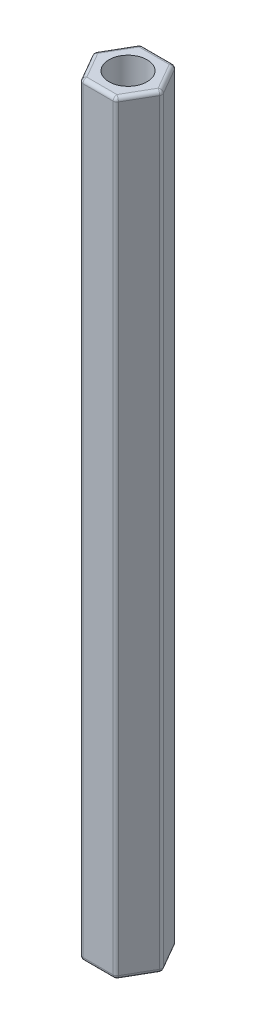
from build123d import *

# Parameters (mm, degrees)
SKETCH_1_R      = 1.5
EXTRUDE_1_DEPTH = 60
FILLET_1_R      = 0.3


with BuildPart() as part:
    # 草图1 → 凸台-拉伸1 (new body)
    with BuildSketch(Plane(origin=(0, 0, 0), x_dir=(1, 0, 0), z_dir=(0, 1, 0))):
        Polygon((2.713546265, 0), (1.356773133, 2.35), (-1.356773133, 2.35), (-2.713546265, 0), (-1.356773133, -2.35), (1.356773133, -2.35), align=None)
        with Locations(Location((0, 0, 0), (0, 0, 270))):
            Circle(SKETCH_1_R, mode=Mode.SUBTRACT)
    extrude(amount=EXTRUDE_1_DEPTH)

    # 圆角1
    fillet_1_edges = [part.edges().sort_by_distance(p)[0] for p in [
        (0, 60, -2.35),
        (1.356773133, 30, 2.35),
        (-1.356773133, 30, 2.35),
        (-2.713546265, 30, 0),
        (-1.356773133, 30, -2.35),
        (1.356773133, 30, -2.35),
        (2.713546265, 30, 0),
        (-2.035159699, 60, -1.175),
        (-2.035159699, 60, 1.175),
        (0, 60, 2.35),
        (2.035159699, 60, 1.175),
        (0, 0, 2.35),
        (-2.035159699, 0, 1.175),
        (-2.035159699, 0, -1.175),
        (2.035159699, 60, -1.175),
        (0, 0, -2.35),
        (2.035159699, 0, -1.175),
        (2.035159699, 0, 1.175),
    ]]
    fillet(fillet_1_edges, radius=FILLET_1_R)


solid = part.part
